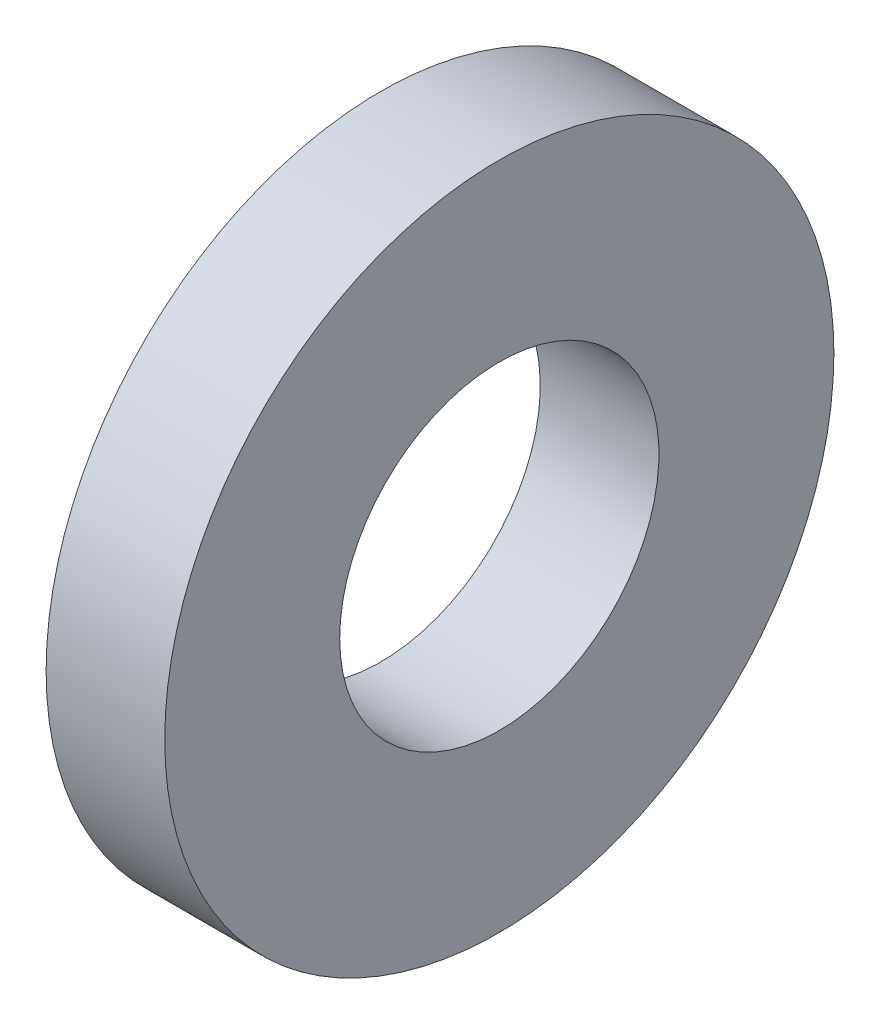
from build123d import *

# Parameters (mm, degrees)
SKETCH1_R      = 26.8605
SKETCH1_R_2    = 12.8143
EXTRUDE1_DEPTH = 9.525


with BuildPart() as part:
    # Sketch1 → Extrude1 (new body)
    with BuildSketch(Plane(origin=(0, 0, 0), x_dir=(0, 0, -1), z_dir=(1, 0, 0))):
        with Locations(Location((0, 0, 0), (0, 0, 180))):
            Circle(SKETCH1_R)
        with Locations(Location((0, 0, 0), (0, 0, 180))):
            Circle(SKETCH1_R_2, mode=Mode.SUBTRACT)
    extrude(amount=EXTRUDE1_DEPTH)


solid = part.part
